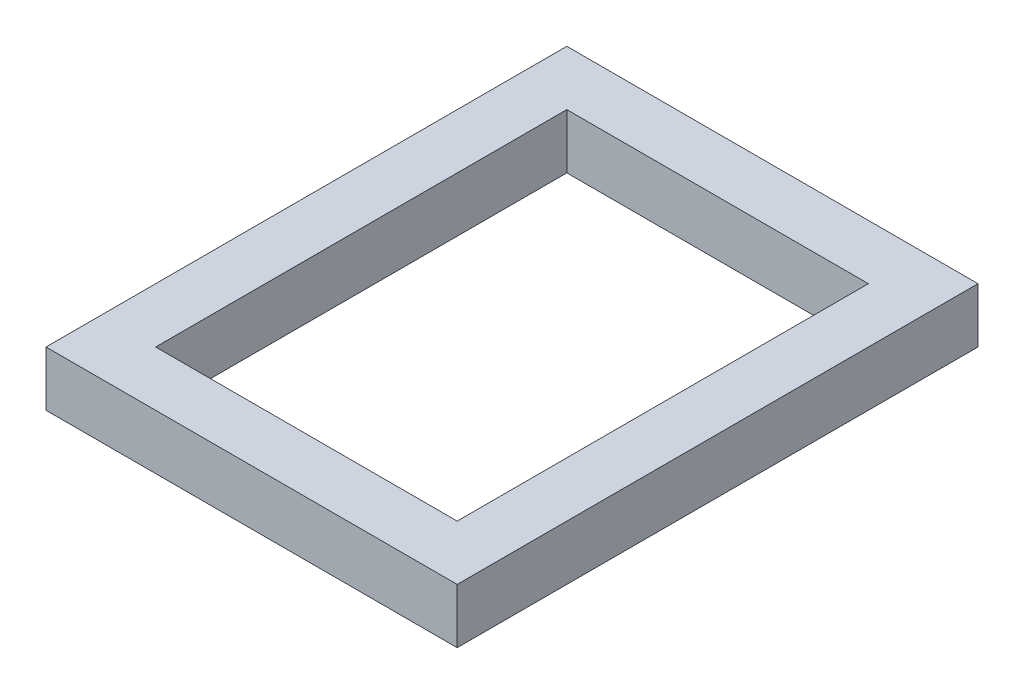
from build123d import *

# Parameters (mm, degrees)
SKETCH1_W           = 95.25
SKETCH1_H           = 120.65
SKETCH1_W_2         = 69.85
SKETCH1_H_2         = 95.25
BOSS_EXTRUDE1_DEPTH = 12.7


with BuildPart() as part:
    # Sketch1 → Boss-Extrude1 (new body)
    with BuildSketch(Plane(origin=(0, 0, 0), x_dir=(1, 0, 0), z_dir=(0, 1, 0))):
        Rectangle(SKETCH1_W, SKETCH1_H)
        Rectangle(SKETCH1_W_2, SKETCH1_H_2, mode=Mode.SUBTRACT)
    extrude(amount=BOSS_EXTRUDE1_DEPTH)


solid = part.part
